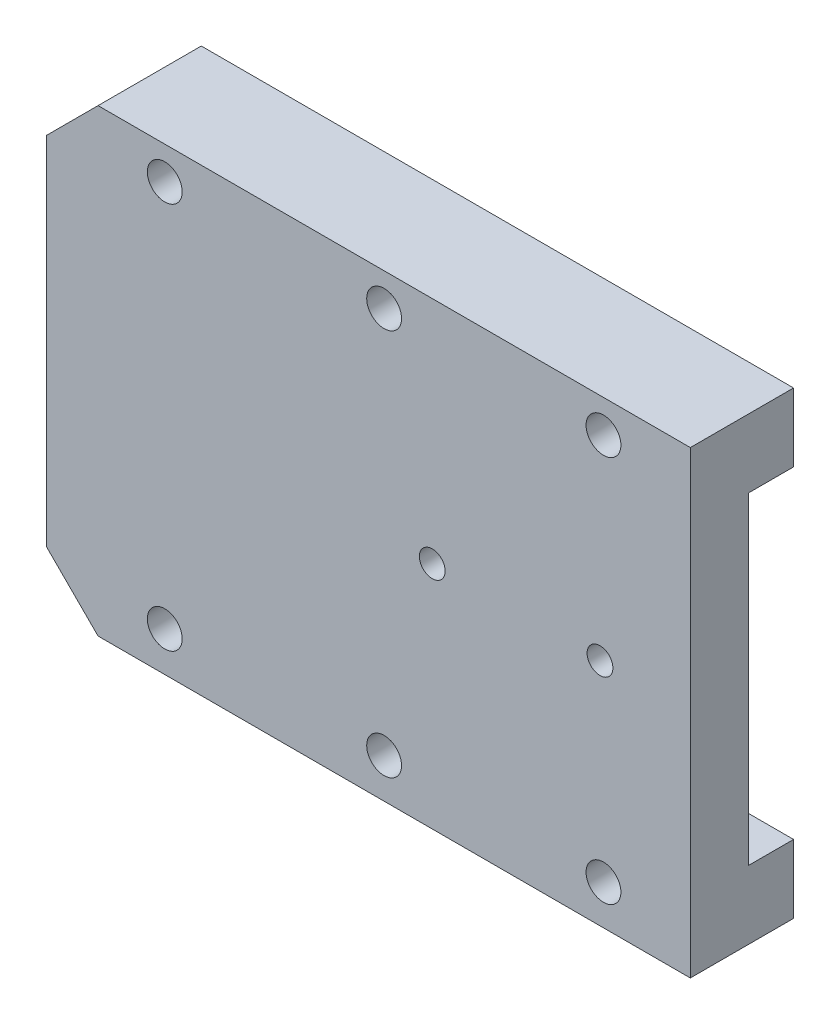
from build123d import *

# Parameters (mm, degrees)
SKETCH1_W           = 45
SKETCH1_H           = 35.6
BOSS_EXTRUDE1_DEPTH = 4
SKETCH2_R           = 1.35
CUT_EXTRUDE1_DEPTH  = 30.784056137
SKETCH3_W           = 4.9
SKETCH3_H           = 35.6
BOSS_EXTRUDE2_DEPTH = 8
CHAMFER1_SIZE       = 4
SKETCH5_W           = 3.5
SKETCH5_H           = 25
CUT_EXTRUDE2_DEPTH  = 54.130499715
SKETCH6_R           = 1
CUT_EXTRUDE4_DEPTH  = 34.639262774


with BuildPart() as part:
    # Sketch1 → Boss-Extrude1 (new, symmetric)
    with BuildSketch(Plane.XY):
        Rectangle(SKETCH1_W, SKETCH1_H)
    extrude(amount=BOSS_EXTRUDE1_DEPTH, both=True)

    # Sketch2 → Cut-Extrude1 (cut, through all)
    with BuildSketch(Plane(origin=(0, 0, -4), x_dir=(-1, 0, 0), z_dir=(0, 0, -1))):
        with Locations((-15.769384845, -14.732901147)):
            Circle(SKETCH2_R)
        with Locations((1.230615155, -14.732901147)):
            Circle(SKETCH2_R)
        with Locations((18.230615155, -14.732901147)):
            Circle(SKETCH2_R)
        with Locations((18.230615155, 15.267098853)):
            Circle(SKETCH2_R)
        with Locations((1.230615155, 15.267098853)):
            Circle(SKETCH2_R)
        with Locations((-15.769384845, 15.267098853)):
            Circle(SKETCH2_R)
    extrude(amount=-CUT_EXTRUDE1_DEPTH, mode=Mode.SUBTRACT)

    # Sketch3 → Boss-Extrude2 (add)
    with BuildSketch(Plane(origin=(0, 0, -4), x_dir=(-1, 0, 0), z_dir=(0, 0, -1))):
        with Locations((24.95, 0)):
            Rectangle(SKETCH3_W, SKETCH3_H)
    extrude(amount=-BOSS_EXTRUDE2_DEPTH)

    # Chamfer1
    chamfer1_edges = [part.edges().sort_by_distance(p)[0] for p in [
        (-27.4, 17.8, 0),
        (-27.4, -17.8, 0),
    ]]
    chamfer(chamfer1_edges, length=CHAMFER1_SIZE)

    # Sketch5 → Cut-Extrude2 (cut, through all)
    with BuildSketch(Plane.ZY.offset(27.4)):
        with Locations((-2.25, 0)):
            Rectangle(SKETCH5_W, SKETCH5_H)
    extrude(amount=-CUT_EXTRUDE2_DEPTH, mode=Mode.SUBTRACT)

    # Sketch6 → Cut-Extrude4 (cut, through all)
    with BuildSketch(Plane.XY.offset(4)):
        with Locations((2.5, 0)):
            Circle(SKETCH6_R)
        with Locations((15.5, 0)):
            Circle(SKETCH6_R)
    extrude(amount=-CUT_EXTRUDE4_DEPTH, mode=Mode.SUBTRACT)


solid = part.part
